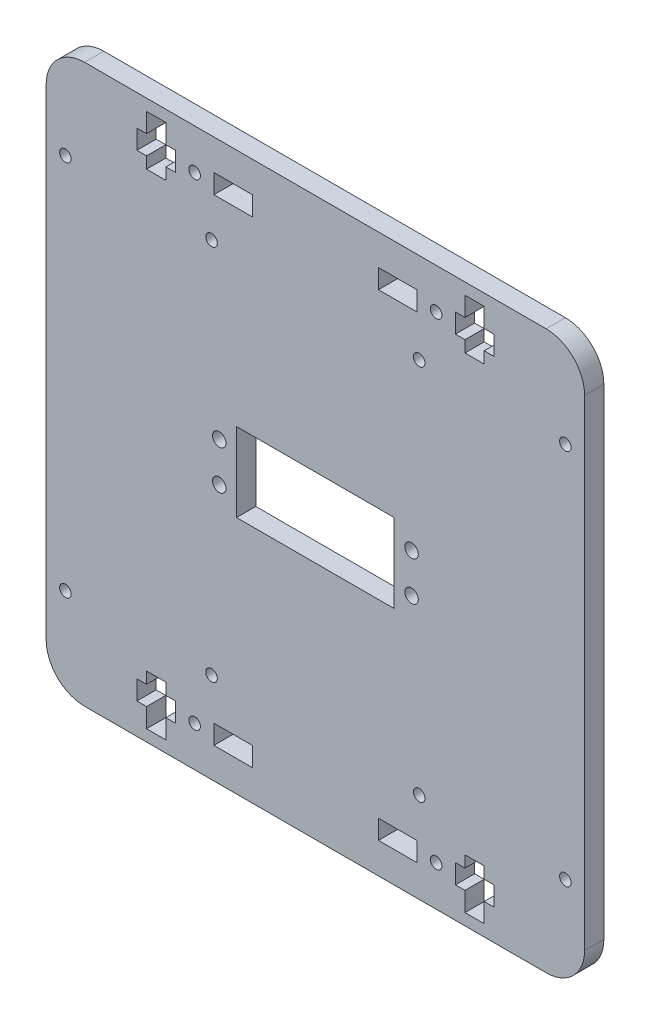
from build123d import *

# Parameters (mm, degrees)
SKETCH1_W           = 140
SKETCH1_H           = 145
BOSS_EXTRUDE1_DEPTH = 5
SKETCH2_W           = 10
SKETCH2_H           = 5
CUT_EXTRUDE1_DEPTH  = 164.343962239
SKETCH3_R           = 1.5
CUT_EXTRUDE2_DEPTH  = 5
SKETCH4_R           = 1.5
CUT_EXTRUDE3_DEPTH  = 164.343962239
SKETCH5_R           = 1.75
SKETCH5_W           = 41
SKETCH5_H           = 20.5
CUT_EXTRUDE4_DEPTH  = 164.343962239
FILLET1_R           = 10


with BuildPart() as part:
    # Sketch1 → Boss-Extrude1 (new body)
    with BuildSketch(Plane.XY):
        with Locations((0, -75)):
            Rectangle(SKETCH1_W, SKETCH1_H)
    extrude(amount=-BOSS_EXTRUDE1_DEPTH)

    # Sketch2 → Cut-Extrude1 (cut, through all)
    with BuildSketch(Plane.XY):
        Polygon((43.894042166, -134.5), (43.894042166, -131.5), (38.894042166, -131.5), (38.894042166, -134.5), (36.394042166, -134.5), (36.394042166, -139.5), (38.894042166, -139.5), (38.894042166, -144.5), (43.894042166, -144.5), (43.894042166, -139.5), (46.394042166, -139.5), (46.394042166, -134.5), align=None)
        with Locations((21.394042166, -137)):
            Rectangle(SKETCH2_W, SKETCH2_H)
        with Locations((-21.394042166, -137)):
            Rectangle(SKETCH2_W, SKETCH2_H)
        Polygon((-46.394042166, -134.5), (-43.894042166, -134.5), (-43.894042166, -131.5), (-38.894042166, -131.5), (-38.894042166, -134.5), (-36.394042166, -134.5), (-36.394042166, -139.5), (-38.894042166, -139.5), (-38.894042166, -144.5), (-43.894042166, -144.5), (-43.894042166, -139.5), (-46.394042166, -139.5), align=None)
        Polygon((-43.894042166, -15.5), (-43.894042166, -18.5), (-38.894042166, -18.5), (-38.894042166, -15.5), (-36.394042166, -15.5), (-36.394042166, -10.5), (-38.894042166, -10.5), (-38.894042166, -5.5), (-43.894042166, -5.5), (-43.894042166, -10.5), (-46.394042166, -10.5), (-46.394042166, -15.5), align=None)
        with Locations((-21.394042166, -13)):
            Rectangle(SKETCH2_W, SKETCH2_H)
        with Locations((21.394042166, -13)):
            Rectangle(SKETCH2_W, SKETCH2_H)
        Polygon((46.394042166, -15.5), (43.894042166, -15.5), (43.894042166, -18.5), (38.894042166, -18.5), (38.894042166, -15.5), (36.394042166, -15.5), (36.394042166, -10.5), (38.894042166, -10.5), (38.894042166, -5.5), (43.894042166, -5.5), (43.894042166, -10.5), (46.394042166, -10.5), align=None)
    extrude(amount=-CUT_EXTRUDE1_DEPTH, mode=Mode.SUBTRACT)

    # Sketch3 → Cut-Extrude2 (cut)
    with BuildSketch(Plane.XY):
        with Locations((31.394042166, -137)):
            Circle(SKETCH3_R)
        with Locations(Location((-31.394042166, -137, 0), (0, 0, 180))):
            Circle(SKETCH3_R)
        with Locations(Location((31.394042166, -13, 0), (0, 0, 180))):
            Circle(SKETCH3_R)
        with Locations((-31.394042166, -13)):
            Circle(SKETCH3_R)
    extrude(amount=-CUT_EXTRUDE2_DEPTH, mode=Mode.SUBTRACT)

    # Sketch4 → Cut-Extrude3 (cut, through all)
    with BuildSketch(Plane.XY):
        with Locations((65, -124)):
            Circle(SKETCH4_R)
        with Locations((27, -124)):
            Circle(SKETCH4_R)
        with Locations(Location((27, -26, 0), (0, 0, 180))):
            Circle(SKETCH4_R)
        with Locations(Location((65, -26, 0), (0, 0, 180))):
            Circle(SKETCH4_R)
        with Locations((-27, -26)):
            Circle(SKETCH4_R)
        with Locations((-65, -26)):
            Circle(SKETCH4_R)
        with Locations(Location((-65, -124, 0), (0, 0, 180))):
            Circle(SKETCH4_R)
        with Locations(Location((-27, -124, 0), (0, 0, 180))):
            Circle(SKETCH4_R)
    extrude(amount=-CUT_EXTRUDE3_DEPTH, mode=Mode.SUBTRACT)

    # Sketch5 → Cut-Extrude4 (cut, through all)
    with BuildSketch(Plane.XY):
        with Locations((25, -80.1)):
            Circle(SKETCH5_R)
        with Locations(Location((25, -69.9, 0), (0, 0, 180))):
            Circle(SKETCH5_R)
        with Locations(Location((-25, -80.1, 0), (0, 0, 180))):
            Circle(SKETCH5_R)
        with Locations((-25, -69.9)):
            Circle(SKETCH5_R)
        with Locations((0, -75)):
            Rectangle(SKETCH5_W, SKETCH5_H)
    extrude(amount=-CUT_EXTRUDE4_DEPTH, mode=Mode.SUBTRACT)

    # Fillet1
    fillet1_edges = [part.edges().sort_by_distance(p)[0] for p in [
        (70, -147.5, -2.5),
        (-70, -147.5, -2.5),
        (-70, -2.5, -2.5),
        (70, -2.5, -2.5),
    ]]
    fillet(fillet1_edges, radius=FILLET1_R)


solid = part.part
